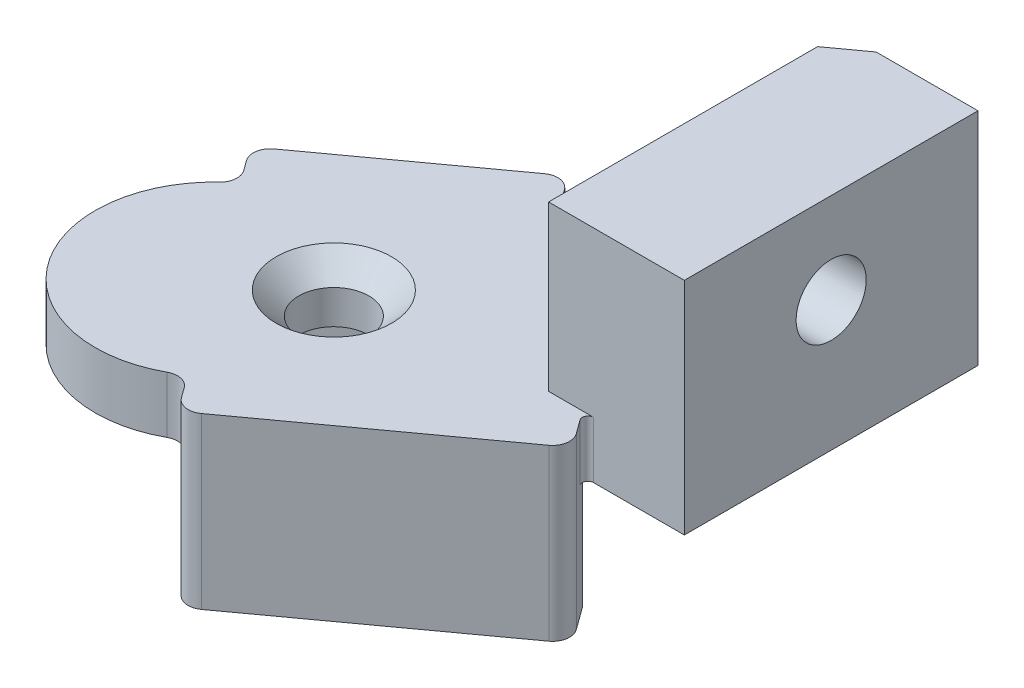
from build123d import *

# Parameters (mm, degrees)
SKETCH_1_R             = 1.55
EXTRUDE_409_DEPTH      = 2.5
EXTRUDE_START          = 2.5
EXTRUDE_652_DEPTH      = 7.5
SKETCH_3_W             = 4.5
SKETCH_3_H             = 12.978713764
EXTRUDE_1_DEPTH        = 9.75
CHAMFER_1_SIZE         = 1
CUT_EXTRUDE_1251_DEPTH = 2
CUT_EXTRUDE_M3_REACH   = 27.038
SKETCH_6_R             = 1.55
EXTRUDE_1_2_DEPTH      = 7.25
CUT_EXTRUDE_1709_DEPTH = 26.037686694
EXTRUDE_START_2        = 1.5
SKETCH_8_R             = 1.55
EXTRUDE_2_DEPTH        = 1.5
FILLET_5_R             = 0.75
FILLET_6_R             = 0.25


with BuildPart() as part:
    # 草图1 → Extrude 409 (new body)
    with BuildSketch(Plane(origin=(0, 0, 0), x_dir=(1, 0, 0), z_dir=(0, 1, 0))):
        with BuildLine():
            Line((10.1243866, 13.845154317), (-6.15423406, 2.01804411))
            ThreePointArc((-6.15423406, 2.01804411), (-7.315700706, -5.315167685), (0.017511089, -6.476634331))
            Line((0.017511089, -6.476634331), (10.1243866, 0.866440553))
            Line((10.1243866, 0.866440553), (10.1243866, 13.845154317))
        make_face()
        with Locations(Location((0, 0, 0), (0, 0, 270))):
            Circle(SKETCH_1_R, mode=Mode.SUBTRACT)
    extrude(amount=EXTRUDE_409_DEPTH)

    # 草图2 → Extrude 652 (add)
    with BuildSketch(Plane(origin=(0, 0, 0), x_dir=(1, 0, 0), z_dir=(0, 1, 0)).offset(EXTRUDE_START)):
        Polygon((0.017511089, -6.476634331), (1.193081594, -8.09466832), (11.299957105, -0.751593436), (10.1243866, 0.866440553), align=None)
        Polygon((-7.329804565, 3.636078099), (0.809505765, 9.549633202), (1.98507627, 7.931599213), (-6.15423406, 2.01804411), align=None)
    extrude(amount=-EXTRUDE_652_DEPTH)

    # 草图3 → Extrude 1 (add)
    with BuildSketch(Plane(origin=(0, 0, 0), x_dir=(1, 0, 0), z_dir=(0, 1, 0))):
        with Locations((12.3743866, 7.355797435)):
            Rectangle(SKETCH_3_W, SKETCH_3_H)
    extrude(amount=EXTRUDE_1_DEPTH)

    # 倒角1
    chamfer_1_edges = [part.edges().sort_by_distance(p)[0] for p in [
        (0, 2.5, -1.55),
    ]]
    chamfer(chamfer_1_edges, length=CHAMFER_1_SIZE)

    # 草图5 → Cut-Extrude 1251 (cut)
    with BuildSketch(Plane.ZY.offset(-10.1243866)):
        Polygon((-4.151503441, 5.755), (-5.753650438, 8.53), (-8.957944432, 8.53), (-10.560091429, 5.755), (-8.957944432, 2.98), (-5.753650438, 2.98), align=None)
    extrude(amount=-CUT_EXTRUDE_1251_DEPTH, mode=Mode.SUBTRACT)

    # 草图6 → M3螺孔 (cut, up to next)
    with BuildSketch(Plane.ZY.offset(-10.1243866), mode=Mode.PRIVATE) as cut_extrude_m3_sk1:
        with Locations((-7.355797435, 5.755)):
            Circle(SKETCH_6_R)
    cut_extrude_m3_tool1 = extrude(cut_extrude_m3_sk1.sketch, amount=-CUT_EXTRUDE_M3_REACH, mode=Mode.PRIVATE) & part.part
    add(cut_extrude_m3_tool1.solids().sort_by_distance((10.124387, 5.755, -7.355797))[0], mode=Mode.SUBTRACT)

    # 草图7 → Extrude 1 2 (add)
    with BuildSketch(Plane(origin=(0, 0, 0), x_dir=(1, 0, 0), z_dir=(0, 1, 0)).offset(EXTRUDE_START)):
        Polygon((10.1243866, 13.845154317), (8.6243866, 12.755340525), (8.6243866, 0.866440553), (10.1243866, 0.866440553), align=None)
    extrude(amount=EXTRUDE_1_2_DEPTH)

    # 草图5<2> → Cut-Extrude 1709 (cut, through all)
    with BuildSketch(Plane.ZY.offset(-10.1243866)):
        Polygon((-4.151503441, 5.755), (-5.753650438, 8.53), (-8.957944432, 8.53), (-10.560091429, 5.755), (-8.957944432, 2.98), (-5.753650438, 2.98), align=None)
    extrude(amount=CUT_EXTRUDE_1709_DEPTH, mode=Mode.SUBTRACT)

    # 草图8 → 结构补强螺母位-2 (add)
    with BuildSketch(Plane.ZY.offset(-12.1243866).offset(EXTRUDE_START_2)):
        Polygon((-5.753650438, 2.98), (-4.151503441, 5.755), (-5.753650438, 8.53), (-8.957944432, 8.53), (-10.560091429, 5.755), (-8.957944432, 2.98), align=None)
        with Locations((-7.355797435, 5.755)):
            Circle(SKETCH_8_R, mode=Mode.SUBTRACT)
    extrude(amount=-EXTRUDE_2_DEPTH)

    # 圆角5
    fillet_5_edges = [part.edges().sort_by_distance(p)[0] for p in [
        (11.299957105, -1.25, 0.751593436),
        (1.193081594, -1.25, 8.09466832),
        (1.98507627, 1.25, -7.931599213),
        (-7.329804565, -1.25, -3.636078099),
        (0.809505765, -1.25, -9.549633202),
        (-6.15423406, 1.25, -2.01804411),
        (0.017511089, 1.25, 6.476634331),
    ]]
    fillet(fillet_5_edges, radius=FILLET_5_R)

    # 圆角6
    fillet_6_edges = [part.edges().sort_by_distance(p)[0] for p in [
        (10.1243866, 1.25, -0.866440553),
    ]]
    fillet(fillet_6_edges, radius=FILLET_6_R)


solid = part.part
